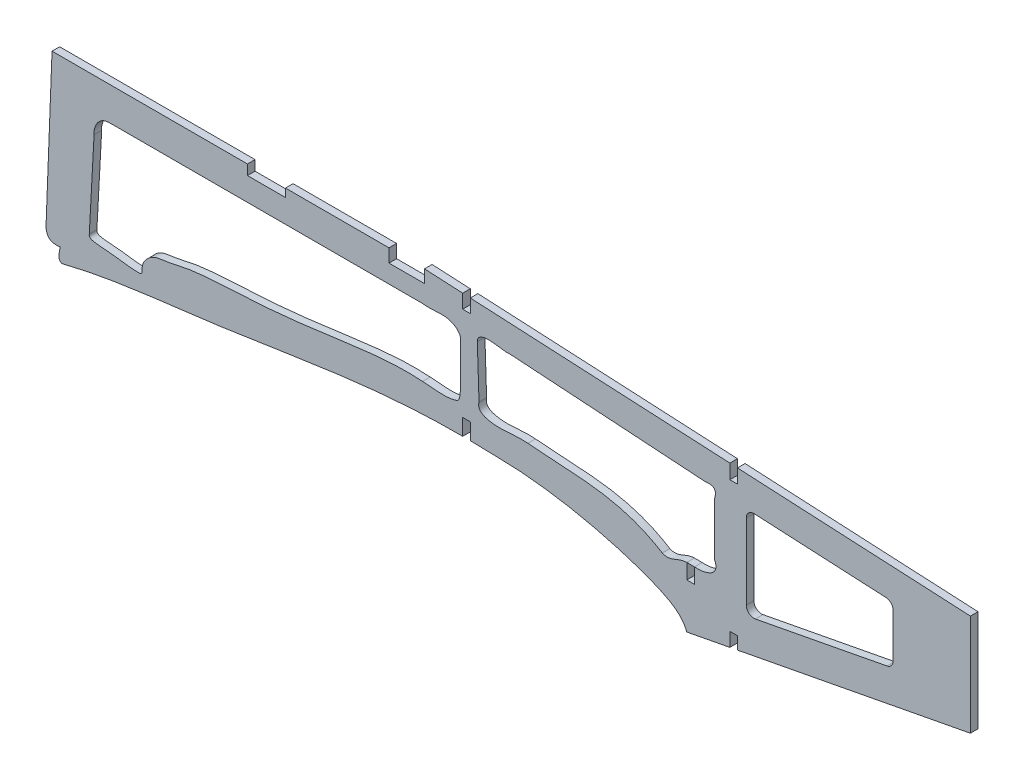
from build123d import *

# Parameters (mm, degrees)
BOSS_EXTRUDE1_DEPTH = 3
CUT_EXTRUDE1_DEPTH  = 10


with BuildPart() as part:
    # Sketch2 → Boss-Extrude1 (new body)
    with BuildSketch(Plane.XY):
        with BuildLine():
            Line((0, 0), (110, 21))
            Line((110, 21), (112, 21.381818182))
            Line((112, 21.381818182), (112, 61.448181818))
            Line((112, 61.448181818), (110, 61.55))
            Line((110, 61.55), (0, 67.15))
            Line((0, 67.15), (-82.390203114, 71.34441034))
            Line((-82.390203114, 71.34441034), (-103.6, 72.424181818))
            Line((-103.6, 72.424181818), (-103.6, 67.37820483))
            Line((-103.6, 67.37820483), (-117.6, 67.37820483))
            Line((-117.6, 67.37820483), (-117.6, 72.601052263))
            Line((-117.6, 72.601052263), (-158.5, 72.601052263))
            Line((-158.5, 72.601052263), (-158.5, 69.364688627))
            Line((-158.5, 69.364688627), (-173.5, 69.364688627))
            Line((-173.5, 69.364688627), (-173.5, 73.331090951))
            Line((-173.5, 73.331090951), (-250.677847371, 73.331090951))
            Line((-250.677847371, 73.331090951), (-253.061371258, 11.961204736))
            add(Edge.make_bspline(
                [(-253.061371258, 11.961204736), (-252.695301584, 7.068046763), (-247.464044481, 8.001792052)],
                knots=[0, 0, 0, 1, 1, 1], degree=2))
            add(Edge.make_bspline(
                [(-246.686111499, 2.633333185), (-248.928327974, 3.154366263), (-247.565880058, 6.601623711), (-247.464044481, 8.001792052)],
                knots=[0, 0, 0, 0, 1, 1, 1, 1], degree=3))
            add(Edge.make_bspline(
                [(-65.333160353, 22.019355812), (-77.480540088, 22.650929106), (-98.896728943, 23.107888404), (-139.769352892, 19.70316867), (-187.764905902, 10.999138586), (-227.306911957, 7.574935575), (-246.686111499, 2.633333185)],
                knots=[0, 0, 0, 0, 0.199691583, 0.351002585, 0.672193729, 1, 1, 1, 1], degree=3))
            add(Edge.make_bspline(
                [(-65.333160353, 22.019355812), (-42.246849715, 20.282066996), (-21.407879052, 14.561565245), (-8.536750112, 8.841063495), (-2.816248361, 7.002330789), (0, 0)],
                knots=[0, 0, 0, 0, 0, 0, 1, 1, 1, 1, 1, 1], degree=5))
        make_face()
        with BuildLine():
            Line((-89.441261827, 54.392298884), (-89.441261827, 37.604150406))
            add(Edge.make_bspline(
                [(-104.329396805, 33.547035275), (-100.682618996, 33.394104005), (-97.382402753, 32.676775417), (-91.130908001, 33.381006052), (-89.678422418, 34.472960488), (-89.441261827, 37.604150406)],
                knots=[0, 0, 0, 0, 0.555990573, 0.846219419, 1, 1, 1, 1], degree=3))
            add(Edge.make_bspline(
                [(-104.329396805, 33.547035275), (-116.493109997, 34.396092023), (-139.929418179, 30.821418593), (-169.962277451, 27.14780605), (-193.860677461, 26.943078993), (-204.040193674, 24.002251793), (-211.121686975, 23.256409578), (-214.802567157, 19.37603681), (-215.291778777, 15.945620099), (-214.944708642, 14.616354017), (-218.189096905, 14.698834441), (-221.731161567, 14.919216265), (-230.68666506, 16.393699305), (-236.468542767, 15.997067549), (-235.965307072, 18.096765723)],
                knots=[0, 0, 0, 0, 0.241115862, 0.431915035, 0.666520812, 0.747658649, 0.783153313, 0.799752274, 0.821747719, 0.858268795, 0.866885423, 0.907913999, 0.932705762, 1, 1, 1, 1], degree=3))
            Line((-235.965307072, 18.096765723), (-234.071503912, 53.114221153))
            add(Edge.make_bspline(
                [(-234.071503912, 53.114221153), (-234.335930921, 55.447445444), (-232.051578262, 60.104673077), (-228.045938699, 60.224858547), (-226.345875639, 60.184031836)],
                knots=[0, 0, 0, 0, 0.618253861, 1, 1, 1, 1], degree=3))
            Line((-226.345875639, 60.184031836), (-104.329396805, 60.184031836))
            add(Edge.make_bspline(
                [(-104.329396805, 60.184031836), (-100.530128109, 59.551333425), (-93.80069914, 61.948546143), (-88.78657296, 56.595347424), (-89.441261827, 54.392298884)],
                knots=[0, 0, 0, 0, 0.661963739, 1, 1, 1, 1], degree=3))
        make_face(mode=Mode.SUBTRACT)
        with BuildLine():
            Line((-70.551573081, 60.184031836), (7.446201395, 55.056640509))
            add(Edge.make_bspline(
                [(7.446201395, 55.056640509), (12.564500916, 55.804176812), (10.9, 50.909005104)],
                knots=[0, 0, 0, 1, 1, 1], degree=2))
            Line((10.9, 50.909005104), (10.9, 30.311377022))
            add(Edge.make_bspline(
                [(-9.682185597, 22.192002613), (-6.891728171, 20.96675296), (-4.065354224, 23.28006022), (1.076965434, 24.030922879), (6.734860441, 23.127593713), (13.079581397, 25.987079624), (10.9, 30.311377022)],
                knots=[0, 0, 0, 0, 0.304362413, 0.391412184, 0.603770874, 1, 1, 1, 1], degree=3))
            add(Edge.make_bspline(
                [(-62.742811391, 33.167576806), (-50.008044132, 31.964235318), (-31.096212571, 32.501506515), (-14.175068968, 24.991386158), (-9.682185597, 22.192002613)],
                knots=[0, 0, 0, 0, 0.709754517, 1, 1, 1, 1], degree=3))
            add(Edge.make_bspline(
                [(-62.742811391, 33.167576806), (-67.936797189, 33.638800445), (-74.145228302, 31.661930968), (-82.862654784, 34.444793752), (-82.056720578, 37.604150406)],
                knots=[0, 0, 0, 0, 0.659769786, 1, 1, 1, 1], degree=3))
            Line((-82.056720578, 37.604150406), (-82.72368565, 57.946585111))
            add(Edge.make_bspline(
                [(-82.72368565, 57.946585111), (-82.824847935, 63.257683512), (-71.023490088, 59.363693918), (-70.551573081, 60.184031836)],
                knots=[0, 0, 0, 0, 1, 1, 1, 1], degree=3))
        make_face(mode=Mode.SUBTRACT)
        with BuildLine():
            Line((81.5, 48.134210925), (81.5, 30.868100536))
            ThreePointArc((81.5, 30.868100536), (80.811677078, 28.955994606), (79.062567275, 27.92131957))
            Line((79.062567275, 27.92131957), (27.062567275, 17.994046843))
            ThreePointArc((27.062567275, 17.994046843), (24.58789407, 18.629150731), (23.5, 20.940827809))
            Line((23.5, 20.940827809), (23.5, 50.781483653))
            ThreePointArc((23.5, 50.781483653), (24.433310525, 52.956062833), (26.652529742, 53.77760359))
            Line((26.652529742, 53.77760359), (78.652529742, 51.130330863))
            ThreePointArc((78.652529742, 51.130330863), (80.674579181, 50.2009004), (81.5, 48.134210925))
        make_face(mode=Mode.SUBTRACT)
    extrude(amount=BOSS_EXTRUDE1_DEPTH)

    # Sketch3 → Cut-Extrude1 (cut)
    with BuildSketch(Plane(origin=(0, 0, 0), x_dir=(-1, 0, 0), z_dir=(0, 0, -1))):
        Polygon((-17, 66.284545455), (-17, 60.584545455), (-20, 60.584545455), (-20, 66.131818182), align=None)
        Polygon((-17, 8.745454545), (-17, 3.245454545), (-20, 3.774800201), (-20, 8.745454545), align=None)
        Polygon((85.5, 71.502727273), (85.5, 66.155454545), (88.5, 66.155454545), (88.5, 71.655454545), align=None)
        Polygon((88.5, 29.150063041), (88.5, 22.550063041), (85.5, 22.666651642), (85.5, 29.150063041), align=None)
        Polygon((0, 23.810746374), (0, 17.810746374), (-3, 17.810746374), (-3, 23.775249064), align=None)
    extrude(amount=-CUT_EXTRUDE1_DEPTH, mode=Mode.SUBTRACT)


solid = part.part
